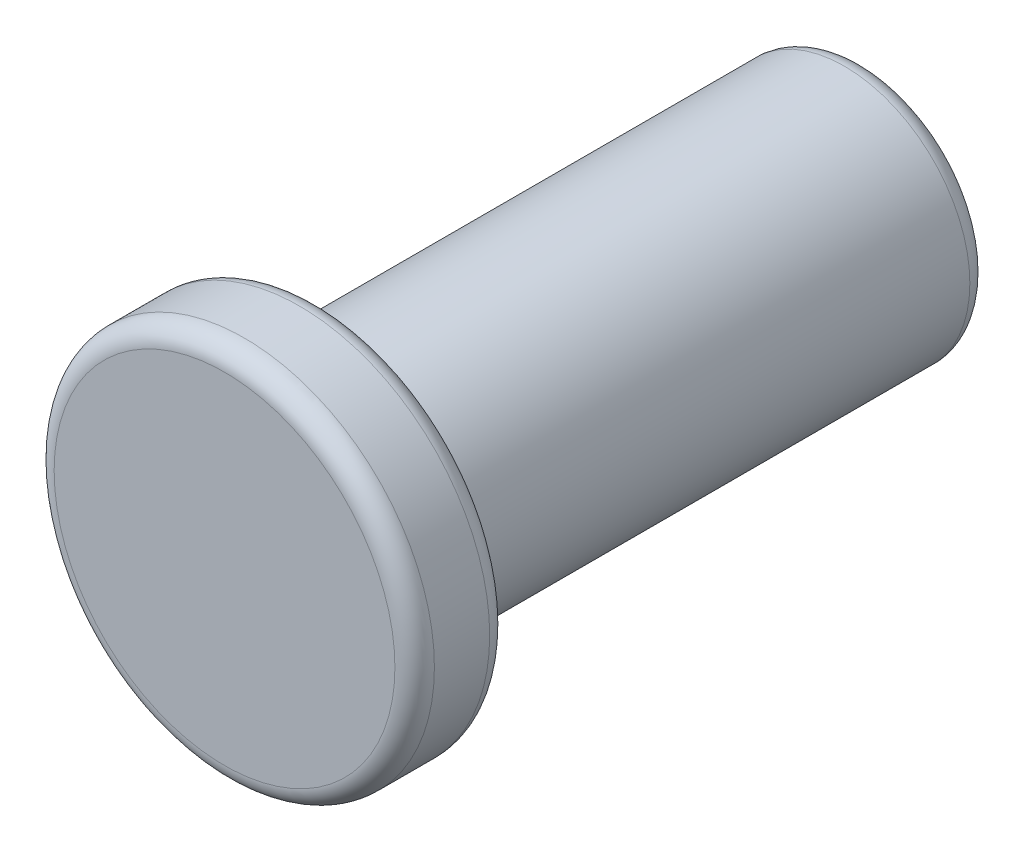
from build123d import *

# Parameters (mm, degrees)
CUT_EXTRUDE1_DEPTH      = 54.63402325
CUT_EXTRUDE1_DEPTH_BACK = 54.63402325
SKETCH2_R               = 1.3
F7F_R                   = 0.5
CUT_EXTRUDE2_DEPTH      = 54.634023349
CUT_EXTRUDE2_DEPTH_BACK = 54.634023349
SKETCH3_W               = 6.35
SKETCH3_H               = 37
FILLET1_R               = 0.5


with BuildPart() as part:
    # Sketch1 → Revolve1 (revolve)
    with BuildSketch(Plane.YZ, mode=Mode.PRIVATE) as revolve1_sk:
        Polygon((0, 0), (4.815, 0), (4.815, -2.4), (3.175, -2.4), (3.175, -53.2), (0, -53.2), align=None)
    revolve(revolve1_sk.sketch.rotate(Axis((0, 0, -335.576810525), (0, 0, 1)), 90), axis=Axis((0, 0, -335.576810525), (0, 0, 1)))

    # Sketch2 → Cut-Extrude1 (cut, two sides: drawn at the far end of the back side and taken through both)
    with BuildSketch(Plane.YZ.offset(-CUT_EXTRUDE1_DEPTH_BACK)):
        with Locations(Location((0, -47.7, 0), (0, 0, 270.000000002))):
            Circle(SKETCH2_R)
        with Locations(Location((0, -42.1, 0), (0, 0, 270.000000002))):
            Circle(SKETCH2_R)
        with Locations(Location((0, -25.3, 0), (0, 0, 270.000000002))):
            Circle(SKETCH2_R)
        with Locations(Location((0, -30.9, 0), (0, 0, 270.000000002))):
            Circle(SKETCH2_R)
        with Locations(Location((0, -36.5, 0), (0, 0, 270.000000002))):
            Circle(SKETCH2_R)
        with Locations(Location((0, -19.7, 0), (0, 0, 270.000000002))):
            Circle(SKETCH2_R)
    extrude(amount=CUT_EXTRUDE1_DEPTH + CUT_EXTRUDE1_DEPTH_BACK, mode=Mode.SUBTRACT)

    # f7f
    f7f_edges = [part.edges().sort_by_distance(p)[0] for p in [
        (4.815, 0, -2.4),
        (4.815, 0, 0),
    ]]
    fillet(f7f_edges, radius=F7F_R)

    # Sketch3 → Cut-Extrude2 (cut, two sides: drawn at the far end of the back side and taken through both)
    with BuildSketch(Plane.YZ.offset(-CUT_EXTRUDE2_DEPTH_BACK)):
        with Locations((0, -34.7)):
            Rectangle(SKETCH3_W, SKETCH3_H)
    extrude(amount=CUT_EXTRUDE2_DEPTH + CUT_EXTRUDE2_DEPTH_BACK, mode=Mode.SUBTRACT)

    # Fillet1
    fillet1_edges = [part.edges().sort_by_distance(p)[0] for p in [
        (3.175, 0, -16.2),
    ]]
    fillet(fillet1_edges, radius=FILLET1_R)


solid = part.part
